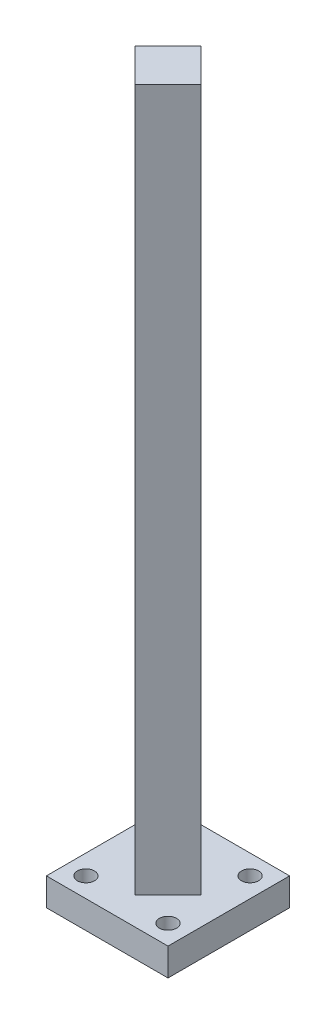
from build123d import *

# Parameters (mm, degrees)
SKETCH_1_W      = 22
SKETCH_1_H      = 22
SKETCH_1_R      = 1.55
EXTRUDE_1_DEPTH = 5
EXTRUDE_2_DEPTH = 127


with BuildPart() as part:
    # 草图1 → 凸台-拉伸1 (new body)
    with BuildSketch(Plane(origin=(0, 0, 0), x_dir=(1, 0, 0), z_dir=(0, 1, 0))):
        Rectangle(SKETCH_1_W, SKETCH_1_H)
        with Locations(Location((-7.424621202, 7.424621202, 0), (0, 0, 270))):
            Circle(SKETCH_1_R, mode=Mode.SUBTRACT)
        with Locations(Location((7.424621202, 7.424621202, 0), (0, 0, 270))):
            Circle(SKETCH_1_R, mode=Mode.SUBTRACT)
        with Locations(Location((7.424621202, -7.424621202, 0), (0, 0, 270))):
            Circle(SKETCH_1_R, mode=Mode.SUBTRACT)
        with Locations(Location((-7.424621202, -7.424621202, 0), (0, 0, 270))):
            Circle(SKETCH_1_R, mode=Mode.SUBTRACT)
    extrude(amount=EXTRUDE_1_DEPTH)

    # 草图2 → 凸台-拉伸2 (add)
    with BuildSketch(Plane(origin=(0, 5, 0), x_dir=(1, 0, 0), z_dir=(0, 1, 0))):
        Polygon((0, 6), (-6, 0), (0, -6), (6, 0), align=None)
    extrude(amount=EXTRUDE_2_DEPTH)


solid = part.part
